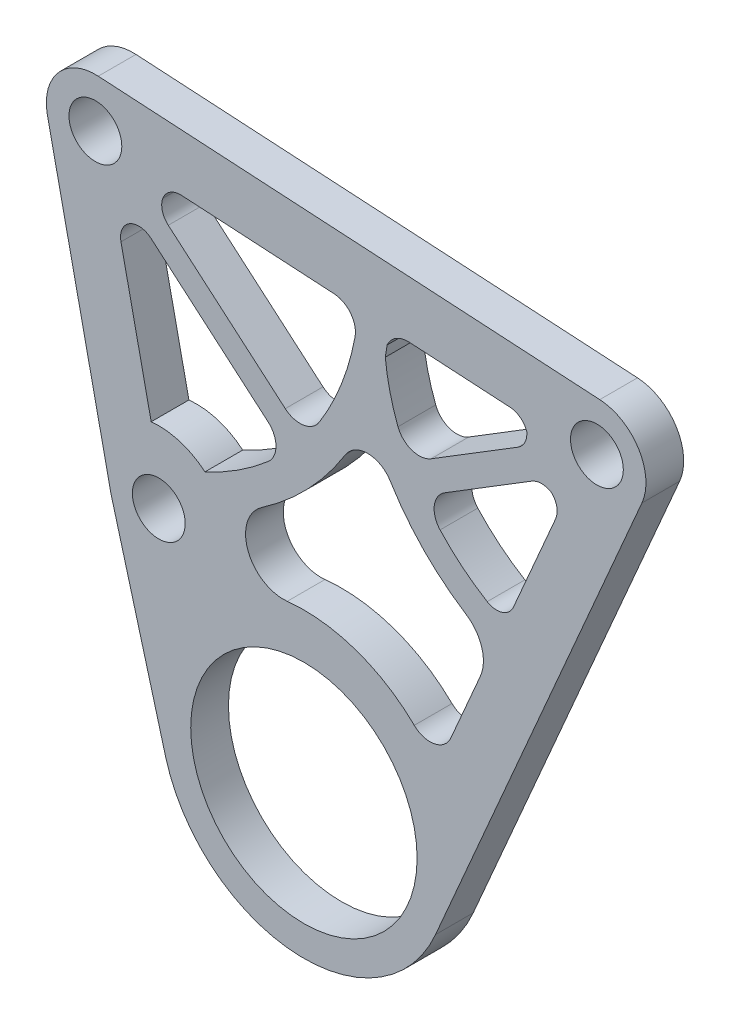
from build123d import *

# Parameters (mm, degrees)
SKETCH1_R               = 3.5
SKETCH1_R_2             = 15
BOSS_EXTRUDE2_DEPTH     = 5
CUT_EXTRUDE5_DEPTH      = 83.400646631
CUT_EXTRUDE5_DEPTH_BACK = 83.400646631
CUT_EXTRUDE6_DEPTH      = 83.400646631
CUT_EXTRUDE6_DEPTH_BACK = 83.400646631


with BuildPart() as part:
    # Sketch1 → Boss-Extrude2 (new body)
    with BuildSketch(Plane.XY):
        with BuildLine():
            ThreePointArc((-27.25170969, 68.621949973), (-32.565561595, 66.364169918), (-33.986309951, 60.768093886))
            Line((-33.986309951, 60.768093886), (-25.586643761, 21.659966753))
            ThreePointArc((-25.586643761, 21.659966753), (-25.54707355, 21.487234362), (-25.502809349, 21.315644849))
            Line((-25.502809349, 21.315644849), (-18.331305953, -4.996320852))
            ThreePointArc((-18.331305953, -4.996320852), (-1.350797033, -18.951921997), (17.437371999, -7.545731095))
            Line((17.437371999, -7.545731095), (44.790602171, 55.664638301))
            ThreePointArc((44.790602171, 55.664638301), (44.35983755, 61.654536494), (39.204715036, 64.734982954))
            Line((39.204715036, 64.734982954), (-27.25170969, 68.621949973))
        make_face()
        with Locations((-27.631239292, 62.133039642)):
            Circle(SKETCH1_R, mode=Mode.SUBTRACT)
        with Locations((38.825185434, 58.246072623)):
            Circle(SKETCH1_R, mode=Mode.SUBTRACT)
        with Locations((-19.231573102, 23.024912509)):
            Circle(SKETCH1_R, mode=Mode.SUBTRACT)
        Circle(SKETCH1_R_2, mode=Mode.SUBTRACT)
    extrude(amount=BOSS_EXTRUDE2_DEPTH)

    # Sketch7 → Cut-Extrude5 (cut, two sides: drawn at the far end of the back side and taken through both)
    with BuildSketch(Plane.XY.offset(-CUT_EXTRUDE5_DEPTH_BACK)):
        with BuildLine():
            Line((-24.243201443, 51.12071929), (-20.237707665, 32.471482957))
            ThreePointArc((-20.237707665, 32.471482957), (-16.449923424, 32.108547523), (-13.108406148, 30.288301969))
            ThreePointArc((-13.108406148, 30.288301969), (-8.731595333, 32.674535637), (-4.738186305, 35.658370146))
            ThreePointArc((-4.738186305, 35.658370146), (-3.700454424, 37.933841025), (-4.747603131, 40.204993764))
            Line((-4.747603131, 40.204993764), (-20.251388243, 53.499512061))
            ThreePointArc((-20.251388243, 53.499512061), (-21.600184602, 54.086137653), (-23.045406965, 53.812799907))
            ThreePointArc((-23.045406965, 53.812799907), (-24.083058347, 52.661975629), (-24.243201443, 51.12071929))
        make_face()
    extrude(amount=CUT_EXTRUDE5_DEPTH + CUT_EXTRUDE5_DEPTH_BACK, mode=Mode.SUBTRACT)

    # Sketch7<3> → Cut-Extrude6 (cut, two sides: drawn at the far end of the back side and taken through both)
    with BuildSketch(Plane.XY.offset(-CUT_EXTRUDE6_DEPTH_BACK)):
        with BuildLine():
            Line((4.005220181, 59.280947081), (-16.230971238, 60.464540827))
            ThreePointArc((-16.230971238, 60.464540827), (-17.729787246, 60.071141831), (-18.708849124, 58.870038157))
            ThreePointArc((-18.708849124, 58.870038157), (-18.758574348, 57.400004307), (-17.973069241, 56.156439333))
            Line((-17.973069241, 56.156439333), (-2.469284129, 42.861921035))
            ThreePointArc((-2.469284129, 42.861921035), (-0.064983066, 42.173450574), (2.025573232, 43.546122983))
            ThreePointArc((2.025573232, 43.546122983), (4.977414301, 49.417863243), (6.779548794, 55.737911554))
            ThreePointArc((6.779548794, 55.737911554), (6.192076358, 58.135617799), (4.005220181, 59.280947081))
        make_face()
        with BuildLine():
            Line((27.766942681, 35.209644428), (33.348917717, 48.108987643))
            ThreePointArc((33.348917717, 48.108987643), (33.512477865, 49.558438608), (32.839288491, 50.852454099))
            ThreePointArc((32.839288491, 50.852454099), (31.516061413, 51.242367015), (30.18747827, 50.871113983))
            Line((30.18747827, 50.871113983), (18.679272595, 43.783562635))
            ThreePointArc((18.679272595, 43.783562635), (17.281206586, 41.643430104), (18.040522196, 39.202488559))
            ThreePointArc((18.040522196, 39.202488559), (20.980340559, 36.423565175), (24.287649202, 34.094046616))
            ThreePointArc((24.287649202, 34.094046616), (26.280456073, 33.862297186), (27.766942681, 35.209644428))
        make_face()
        with BuildLine():
            ThreePointArc((21.483147911, 31.241894358), (15.918845504, 35.767827579), (11.498679992, 41.416515006))
            Line((11.498679992, 41.416515006), (11.497097402, 41.415540337))
            ThreePointArc((11.497097402, 41.415540337), (8.523648804, 43.182837706), (5.483845255, 41.532282971))
            ThreePointArc((5.483845255, 41.532282971), (0.559543941, 35.183461896), (-5.561267488, 29.978470067))
            ThreePointArc((-5.561267488, 29.978470067), (-7.422805487, 24.125679952), (-2.206440861, 20.883764477))
            ThreePointArc((-2.206440861, 20.883764477), (6.856161822, 19.849258048), (14.625251307, 15.069904585))
            ThreePointArc((14.625251307, 15.069904585), (17.298768965, 14.280178644), (19.467842186, 16.031316872))
            Line((19.467842186, 16.031316872), (23.370103648, 25.049022897))
            ThreePointArc((23.370103648, 25.049022897), (23.564224135, 28.492082606), (21.483147911, 31.241894358))
        make_face()
        with BuildLine():
            Line((16.843883891, 46.763721743), (28.352089566, 53.85127309))
            ThreePointArc((28.352089566, 53.85127309), (29.281554059, 54.870744477), (29.52876331, 56.227989384))
            ThreePointArc((29.52876331, 56.227989384), (28.676191314, 57.411652758), (27.308139041, 57.917983644))
            Line((27.308139041, 57.917983644), (13.941676384, 58.699774114))
            ThreePointArc((13.941676384, 58.699774114), (12.198740022, 58.263103257), (11.01733755, 56.909294999))
            ThreePointArc((11.01733755, 56.909294999), (10.906611403, 56.14688363), (10.780846845, 55.386808205))
            ThreePointArc((10.780846845, 55.386808205), (11.390405083, 51.765860667), (12.465443048, 48.254861422))
            ThreePointArc((12.465443048, 48.254861422), (14.303549595, 46.47831417), (16.843883891, 46.763721743))
        make_face()
    extrude(amount=CUT_EXTRUDE6_DEPTH + CUT_EXTRUDE6_DEPTH_BACK, mode=Mode.SUBTRACT)


solid = part.part
